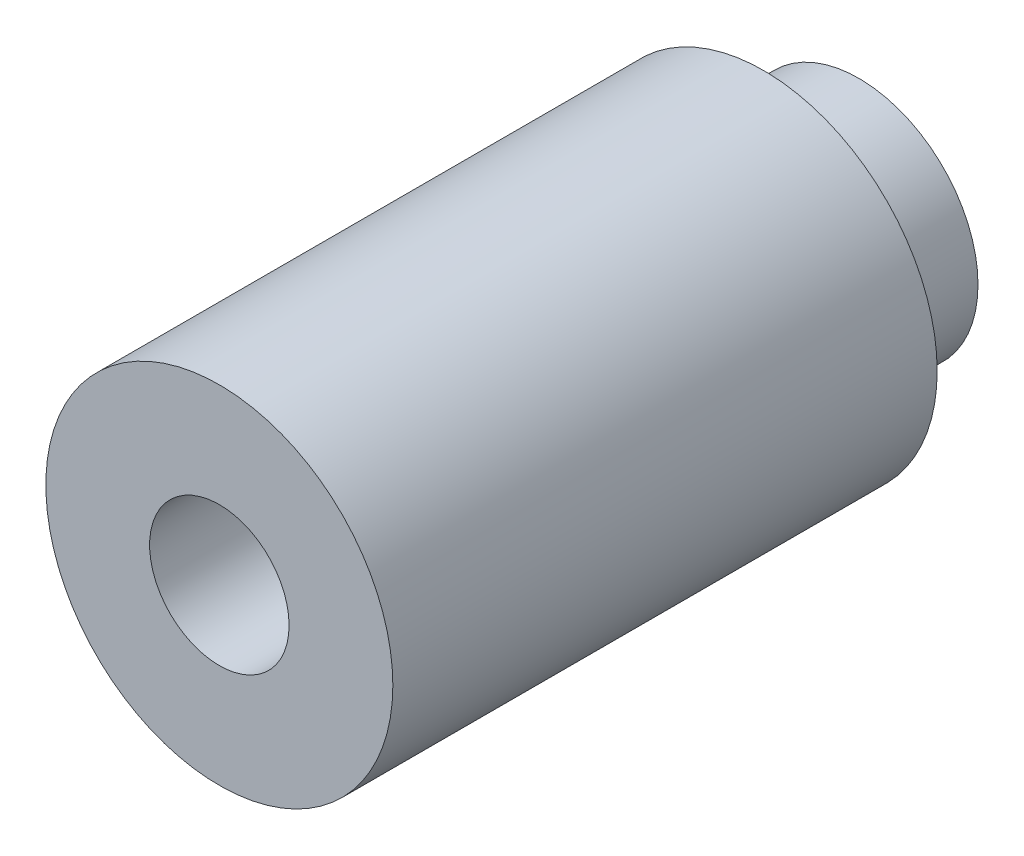
from build123d import *

# Parameters (mm, degrees)
MAIN_FEATURES_R          = 2.55
BODY_DEPTH               = 8
SKETCH1_3_R              = 1.75
PEG_DEPTH                = 1.4
M2_5X0_45_TAPPED_HOLE1_D = 2.05


with BuildPart() as part:
    # main_features → body (new body)
    with BuildSketch(Plane.XY):
        Circle(MAIN_FEATURES_R)
    extrude(amount=BODY_DEPTH)

    # Sketch1<3> → peg (add)
    with BuildSketch(Plane.XY):
        Circle(SKETCH1_3_R)
    extrude(amount=-PEG_DEPTH)

    # M2.5x0.45 Tapped Hole1 (through all)
    with Locations(Plane.XY.offset(8)):
        with Locations((0, 0)):
            Hole(M2_5X0_45_TAPPED_HOLE1_D / 2)


solid = part.part
